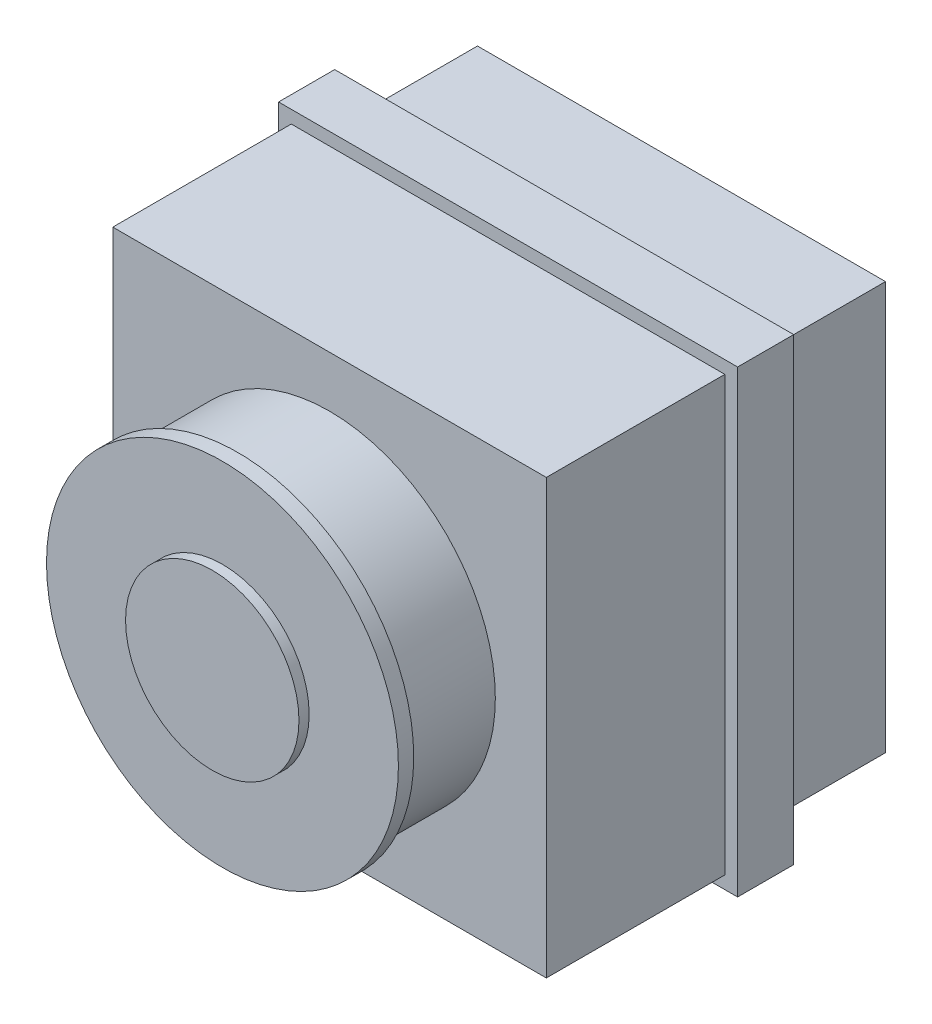
from build123d import *

# Parameters (mm, degrees)
SKETCH_1_W        = 8
SKETCH_1_H        = 8
FOAM_PAD_DEPTH    = 2.3
SENSOR_START      = 2.3
SKETCH_2_W        = 9
SKETCH_2_H        = 9
SENSOR_PCB_DEPTH  = 1.1
LENS_START        = 3.4
SKETCH_3_W        = 8.5
SKETCH_3_H        = 8.5
LENS_HOLDER_DEPTH = 3.5
LENS_START_2      = 6.9
SKETCH_4_R        = 3.25
LENS_BARREL_DEPTH = 1.8
LENS_START_3      = 8.7
SKETCH_5_R        = 3.45
LENS_RING_DEPTH   = 0.3
LENS_START_4      = 9
SKETCH_6_R        = 1.7
LENS_GLASS_DEPTH  = 0.2


with BuildPart() as part:
    # 草圖1 → foam pad (new body)
    with BuildSketch(Plane.XY):
        with Locations((30, -25)):
            Rectangle(SKETCH_1_W, SKETCH_1_H)
    extrude(amount=FOAM_PAD_DEPTH)

    # 草圖2 → sensor PCB (add)
    with BuildSketch(Plane.XY.offset(SENSOR_START)):
        with Locations((30, -25)):
            Rectangle(SKETCH_2_W, SKETCH_2_H)
    extrude(amount=SENSOR_PCB_DEPTH)

    # 草圖3 → lens holder (add)
    with BuildSketch(Plane.XY.offset(LENS_START)):
        with Locations((30, -25)):
            Rectangle(SKETCH_3_W, SKETCH_3_H)
    extrude(amount=LENS_HOLDER_DEPTH)

    # 草圖4 → lens barrel (add)
    with BuildSketch(Plane.XY.offset(LENS_START_2)):
        with Locations((30, -25)):
            Circle(SKETCH_4_R)
    extrude(amount=LENS_BARREL_DEPTH)

    # 草圖5 → lens ring (add)
    with BuildSketch(Plane.XY.offset(LENS_START_3)):
        with Locations((30, -25)):
            Circle(SKETCH_5_R)
    extrude(amount=LENS_RING_DEPTH)

    # 草圖6 → lens glass (add)
    with BuildSketch(Plane.XY.offset(LENS_START_4)):
        with Locations((30, -25)):
            Circle(SKETCH_6_R)
    extrude(amount=LENS_GLASS_DEPTH)


solid = part.part
